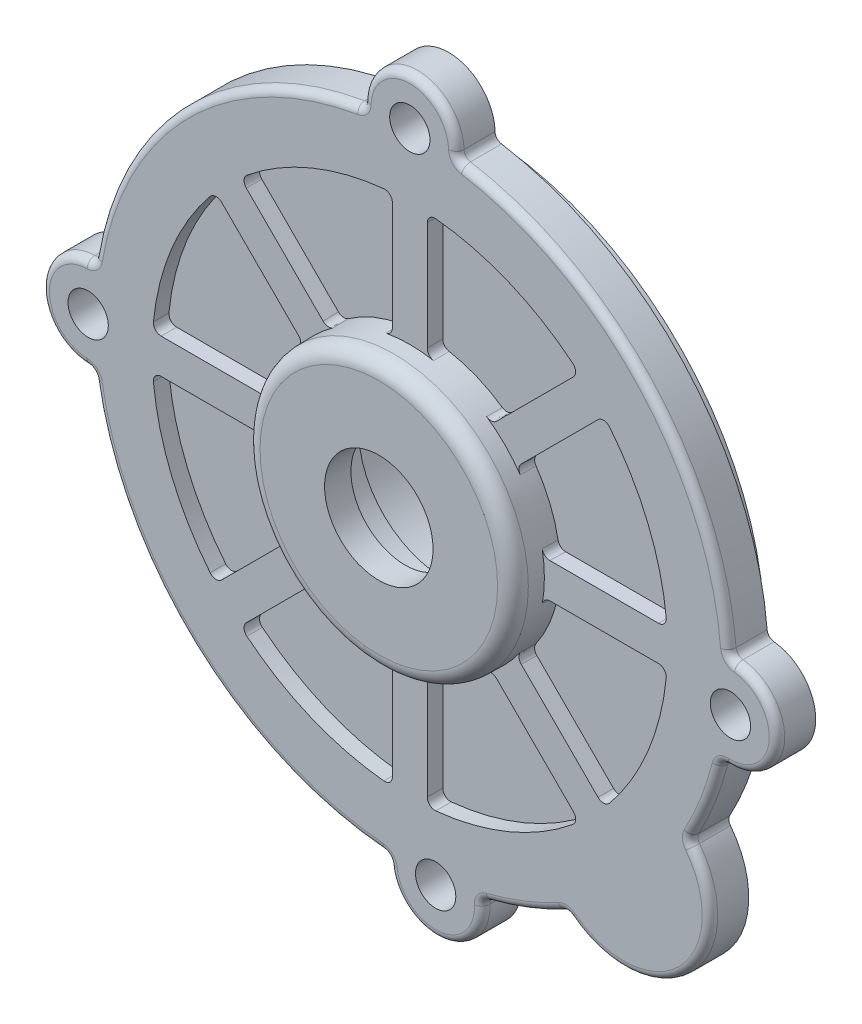
from build123d import *

# Parameters (mm, degrees)
BOSS_EXTRU_1_DEPTH           = 5
ESQUISSE29_R                 = 37.75
BOSS_EXTRU_2_DEPTH           = 3
ESQUISSE33_R                 = 2.6
ENL_V_MAT_EXTRU_1_DEPTH      = 107.476106468
ENL_V_MAT_EXTRU_2_DEPTH      = 2
R_P_TITION_CIRCULAIRE1_COUNT = 8
CONG_1_R                     = 1
CONG_2_R                     = 1
CONG_3_R                     = 1


with BuildPart() as part:
    # Esquisse28 → Boss.-Extru.1 (new body)
    with BuildSketch(Plane.XY):
        with BuildLine():
            ThreePointArc((-21.578860268, 69.219806463), (-27.577164466, 75.077164466), (-33.575468665, 69.219806463))
            ThreePointArc((-33.575468665, 69.219806463), (-33.819493785, 68.588653241), (-34.409552385, 68.257392776))
            ThreePointArc((-34.409552385, 68.257392776), (-56.74531919, 56.74531919), (-68.257392776, 34.409552385))
            ThreePointArc((-68.257392776, 34.409552385), (-68.588653241, 33.819493785), (-69.219806463, 33.575468665))
            ThreePointArc((-69.219806463, 33.575468665), (-75.077164466, 27.577164466), (-69.219806463, 21.578860268))
            ThreePointArc((-69.219806463, 21.578860268), (-68.588653241, 21.334835148), (-68.257392776, 20.744776548))
            ThreePointArc((-68.257392776, 20.744776548), (-55.550125925, -2.739100594), (-31.121983898, -13.520241233))
            ThreePointArc((-31.121983898, -13.520241233), (-30.507238223, -13.803066981), (-30.213336093, -14.412594819))
            ThreePointArc((-30.213336093, -14.412594819), (-23.764201772, -19.769549416), (-18.255441664, -13.449592287))
            ThreePointArc((-18.255441664, -13.449592287), (-18.062868531, -12.800887242), (-17.501305332, -12.423330065))
            ThreePointArc((-17.501305332, -12.423330065), (-12.607865783, -10.860871344), (-7.94656305, -8.702333711))
            ThreePointArc((-7.94656305, -8.702333711), (-7.387644608, -8.585289239), (-6.855799749, -8.793208163))
            ThreePointArc((-6.855799749, -8.793208163), (7.88424061, -7.88424061), (8.793208163, 6.855799749))
            ThreePointArc((8.793208163, 6.855799749), (8.585289239, 7.387644608), (8.702333711, 7.94656305))
            ThreePointArc((8.702333711, 7.94656305), (10.860871344, 12.607865783), (12.423330065, 17.501305332))
            ThreePointArc((12.423330065, 17.501305332), (12.800887242, 18.062868531), (13.449592287, 18.255441664))
            ThreePointArc((13.449592287, 18.255441664), (19.769549416, 23.764201772), (14.412594819, 30.213336093))
            ThreePointArc((14.412594819, 30.213336093), (13.803066981, 30.507238223), (13.520241233, 31.121983898))
            ThreePointArc((13.520241233, 31.121983898), (2.739100594, 55.550125925), (-20.744776548, 68.257392776))
            ThreePointArc((-20.744776548, 68.257392776), (-21.334835148, 68.588653241), (-21.578860268, 69.219806463))
        make_face()
    extrude(amount=BOSS_EXTRU_1_DEPTH)

    # Esquisse29 → Boss.-Extru.2 (add)
    with BuildSketch(Plane(origin=(0, 0, 0), x_dir=(-1, 0, 0), z_dir=(0, 0, -1))):
        with Locations((27.577164466, 27.577164466)):
            Circle(ESQUISSE29_R)
    extrude(amount=BOSS_EXTRU_2_DEPTH)

    # Esquisse33 → Enlèv. mat.-Extru.1 (cut, through all)
    with BuildSketch(Plane.XY.offset(5)):
        with Locations((-27.577164466, 69.077164466)):
            Circle(ESQUISSE33_R)
        with Locations((13.788911873, 24.245839165)):
            Circle(ESQUISSE33_R)
        with Locations((-24.245839165, -13.788911873)):
            Circle(ESQUISSE33_R)
        with Locations((-69.077164466, 27.577164466)):
            Circle(ESQUISSE33_R)
    extrude(amount=-ENL_V_MAT_EXTRU_1_DEPTH, mode=Mode.SUBTRACT)

    # Esquisse34 → Enlèv. mat.-Extru.2 (cut)
    with BuildSketch(Plane.XY.offset(5)):
        with BuildLine():
            Line((-29.827164466, 59.662986881), (-29.827164466, 33.009144982))
            Line((-29.827164466, 33.009144982), (-48.674276818, 51.856257333))
            ThreePointArc((-48.674276818, 51.856257333), (-48.965896531, 52.613815962), (-48.599418271, 53.338129995))
            ThreePointArc((-48.599418271, 53.338129995), (-40.301388592, 58.296158922), (-30.92793966, 60.657896103))
            ThreePointArc((-30.92793966, 60.657896103), (-30.156633033, 60.404868001), (-29.827164466, 59.662986881))
        make_face()
    enl_v_mat_extru_2 = extrude(amount=-ENL_V_MAT_EXTRU_2_DEPTH, mode=Mode.SUBTRACT)

    # Répétition circulaire1: Enlèv. mat.-Extru.2 ×8 about axis
    r_p_tition_circulaire1_axis = Axis((-27.577164466, 27.577164466, 0), (0, 0, 1))
    for i in range(1, R_P_TITION_CIRCULAIRE1_COUNT):
        add(enl_v_mat_extru_2.rotate(r_p_tition_circulaire1_axis, i * 360 / R_P_TITION_CIRCULAIRE1_COUNT), mode=Mode.SUBTRACT)

    # Esquisse31 → Révolution1 (revolve)
    with BuildSketch(Plane(origin=(-27.577164466, 0, 0), x_dir=(0, 0, -1), z_dir=(1, 0, 0))):
        with BuildLine():
            Line((3, 43.577164466), (3, 45.077164466))
            Line((3, 45.077164466), (-7.034904813, 44.902004551))
            ThreePointArc((-7.034904813, 44.902004551), (-8.426500898, 44.30412769), (-9, 42.902309161))
            Line((-9, 42.902309161), (-9, 27.577164466))
            Line((-9, 27.577164466), (7.4, 27.577164466))
            Line((7.4, 27.577164466), (7.4, 42.517664917))
            ThreePointArc((7.4, 42.517664917), (7.113250449, 43.218574182), (6.417452406, 43.517512613))
            Line((6.417452406, 43.517512613), (3, 43.577164466))
        make_face()
    revolve(axis=Axis((-27.577164466, 27.577164466, 22.696358266), (0, 0, -1)))

    # Esquisse32 → Enlèvement de matière-Révolution1 (revolve, cut)
    with BuildSketch(Plane(origin=(-27.577164466, 0, 0), x_dir=(0, 0, -1), z_dir=(1, 0, 0))):
        Polygon((-0.6, 40.577164466), (7.4, 40.577164466), (7.4, 27.577164466), (-9, 27.577164466), (-9, 34.577164466), (-5.6, 34.577164466), (-5.6, 38.577164466), (-0.6, 38.577164466), align=None)
        Polygon((0, 43.629529661), (3, 43.577164466), (3, 62.577164466), (0, 62.577164466), align=None)
    revolve(axis=Axis((-27.577164466, 27.577164466, 15.825783133), (0, 0, -1)), mode=Mode.SUBTRACT)

    # Congé1
    cong_1_edges = [part.edges().sort_by_distance(p)[0] for p in [
        (-33.819493785, 68.588653241, 5),
        (-27.577164466, 75.077164466, 5),
        (-21.334835148, 68.588653241, 5),
        (2.739100594, 55.550125925, 5),
        (13.803066981, 30.507238223, 5),
        (19.769549416, 23.764201772, 5),
        (12.800887242, 18.062868531, 5),
        (-12.607865783, -10.860871344, 5),
        (-18.062868531, -12.800887242, 5),
        (-23.764201772, -19.769549416, 5),
        (-30.507238223, -13.803066981, 5),
        (-55.550125925, -2.739100594, 5),
        (-68.588653241, 21.334835148, 5),
        (-75.077164466, 27.577164466, 5),
        (-68.588653241, 33.819493785, 5),
        (-56.74531919, 56.74531919, 5),
        (10.860871344, 12.607865783, 5),
        (8.585289239, 7.387644608, 5),
        (7.88424061, -7.88424061, 5),
        (-7.387644608, -8.585289239, 5),
    ]]
    fillet(cong_1_edges, radius=CONG_1_R)

    # Congé2
    cong_2_edges = [part.edges().sort_by_distance(p)[0] for p in [
        (-41.352692844, 16.983616604, 4.000000003),
        (-38.170712328, 13.801636089, 4.000000003),
        (-25.327164466, 10.345625406, 4.000000003),
        (-29.827164466, 10.345625406, 4.000000003),
        (-16.983616604, 13.801636089, 4.000000003),
        (-13.801636089, 16.983616604, 4.000000003),
        (-10.345625406, 25.327164466, 4.000000003),
        (-10.345625406, 29.827164466, 4.000000003),
        (-13.801636089, 38.170712328, 4.000000003),
        (-16.983616604, 41.352692844, 4.000000003),
        (-25.327164466, 44.808703526, 4.000000003),
        (-29.827164466, 44.808703526, 4.000000003),
        (-38.170712328, 41.352692844, 4.000000003),
        (-44.808703526, 25.327164466, 4.000000003),
        (-44.808703526, 29.827164466, 4.000000003),
        (-41.352692844, 38.170712328, 4.000000003),
    ]]
    fillet(cong_2_edges, radius=CONG_2_R)

    # Congé3
    cong_3_edges = [part.edges().sort_by_distance(p)[0] for p in [
        (-27.577164466, -7.422835534, 0),
        (-27.577164466, 11.524799271, 0),
    ]]
    fillet(cong_3_edges, radius=CONG_3_R)


solid = part.part
